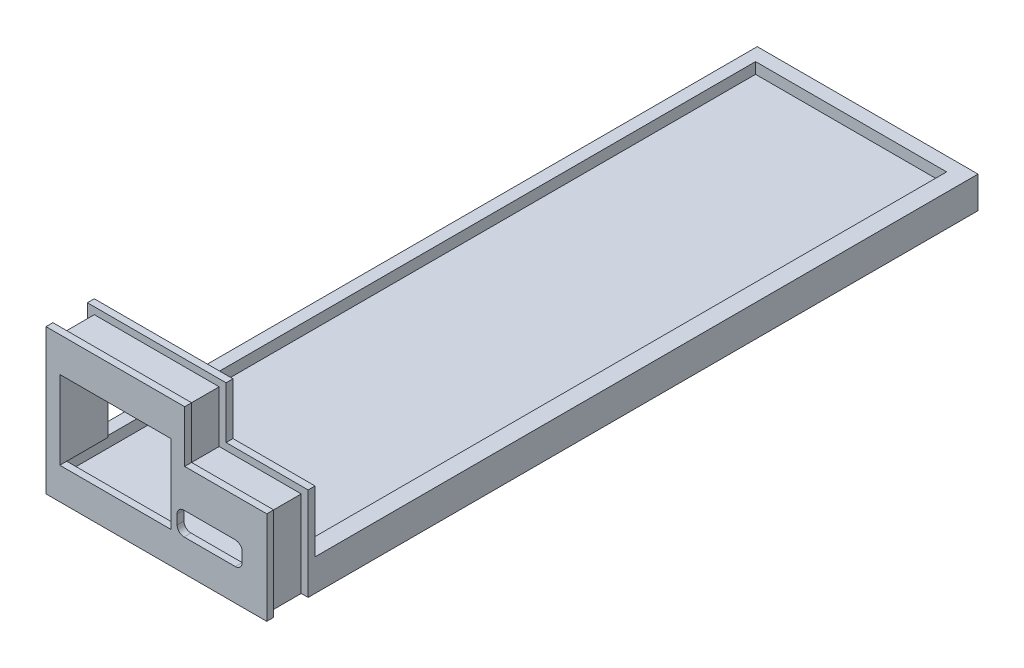
from build123d import *

# Parameters (mm, degrees)
EXTRUDE_2_DEPTH     = 5
EXTRUDE_3_DEPTH     = 1
EXTRUDE_4_DEPTH     = 1
CUT_EXTRUDE_1_DEPTH = 36.801015056
SKETCH_14_W         = 27.70005588
SKETCH_14_H         = 1.6
CUT_EXTRUDE_2_DEPTH = 6
EXTRUDE_7_DEPTH     = 94.1
SKETCH_16_W         = 32
SKETCH_16_H         = 4.6
EXTRUDE_8_DEPTH     = 2
SKETCH_18_W         = 0.9
SKETCH_18_H         = 1
EXTRUDE_10_DEPTH    = 3.36
FILLET_2_R          = 1


with BuildPart() as part:
    # 草图10 → 凸台-拉伸2 (new body)
    with BuildSketch(Plane.XY):
        Polygon((-0.85513843, -3), (29.14486157, -3), (29.14486157, 9.5), (17.247172974, 9.5), (17.247172974, 17), (-0.85513843, 17), align=None)
        Polygon((0.14486157, 1.6), (0.14486157, 13), (16.247172974, 13), (16.247172974, 4.96), (26.583063246, 4.96), (26.583063246, 1.6), align=None, mode=Mode.SUBTRACT)
    extrude(amount=EXTRUDE_2_DEPTH)

    # 草图11 → 凸台-拉伸3 (add)
    with BuildSketch(Plane.XY.offset(5)):
        Polygon((-1.85513843, -3), (30.14486157, -3), (30.14486157, 10.5), (18.247172974, 10.5), (18.247172974, 18), (-1.85513843, 18), align=None)
    extrude(amount=EXTRUDE_3_DEPTH)

    # 草图12 → 凸台-拉伸4 (add)
    with BuildSketch(Plane(origin=(0, 0, 0), x_dir=(-1, 0, 0), z_dir=(0, 0, -1))):
        Polygon((0.85513843, -3), (1.85513843, -3), (1.85513843, 18), (-18.247172974, 18), (-18.247172974, 10.5), (-30.14486157, 10.5), (-30.14486157, -3), (-29.14486157, -3), align=None)
    extrude(amount=EXTRUDE_4_DEPTH)

    # 草图13 → 切除-拉伸1 (cut, through all)
    with BuildSketch(Plane.XY.offset(6)):
        Polygon((16.247172974, 4.96), (16.247172974, 13), (0.14486157, 13), (0.14486157, 1.6), (26.583063246, 1.6), (26.583063246, 4.96), align=None)
    extrude(amount=-CUT_EXTRUDE_1_DEPTH, mode=Mode.SUBTRACT)

    # 草图14 → 切除-拉伸2 (cut)
    with BuildSketch(Plane(origin=(0, 0, -1), x_dir=(-1, 0, 0), z_dir=(0, 0, -1))):
        with Locations((-13.75002794, 0.8)):
            Rectangle(SKETCH_14_W, SKETCH_14_H)
    extrude(amount=-CUT_EXTRUDE_2_DEPTH, mode=Mode.SUBTRACT)

    # 草图15 → 凸台-拉伸7 (add)
    with BuildSketch(Plane(origin=(0, 0, -1), x_dir=(-1, 0, 0), z_dir=(0, 0, -1))):
        Polygon((-30.14486157, -3), (1.85513843, -3), (1.85513843, 1.6), (0.1, 1.6), (0.1, 0), (-27.60005588, 0), (-27.60005588, 1.6), (-30.14486157, 1.6), align=None)
    extrude(amount=EXTRUDE_7_DEPTH)

    # 草图16 → 凸台-拉伸8 (add)
    with BuildSketch(Plane(origin=(0, 0, -95.1), x_dir=(-1, 0, 0), z_dir=(0, 0, -1))):
        with Locations((-14.14486157, -0.7)):
            Rectangle(SKETCH_16_W, SKETCH_16_H)
    extrude(amount=EXTRUDE_8_DEPTH)

    # 草图18 → 凸台-拉伸10 (add)
    with BuildSketch(Plane(origin=(0, 1.6, 0), x_dir=(1, 0, 0), z_dir=(0, 1, 0))):
        with Locations((16.697172974, -5.5)):
            Rectangle(SKETCH_18_W, SKETCH_18_H)
    extrude(amount=EXTRUDE_10_DEPTH)

    # 圆角2
    fillet_2_edges = [part.edges().sort_by_distance(p)[0] for p in [
        (17.147172974, 4.96, 5.5),
        (17.147172974, 1.6, 5.5),
        (26.583063246, 1.6, 5.5),
        (26.583063246, 4.96, 2.5),
    ]]
    fillet(fillet_2_edges, radius=FILLET_2_R)


solid = part.part
